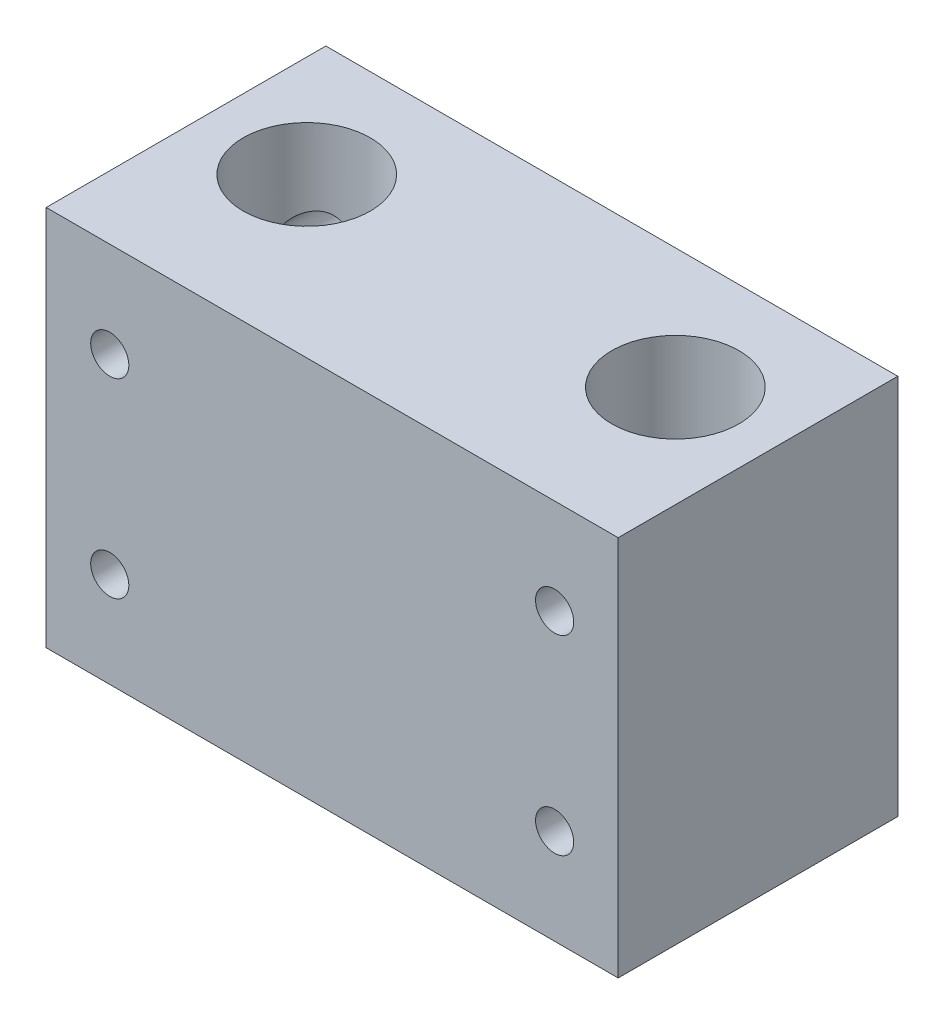
from build123d import *

# Parameters (mm, degrees)
SKETCH1_W           = 45
SKETCH1_H           = 30
BOSS_EXTRUDE2_DEPTH = 25
SKETCH4_R           = 1.5
CUT_EXTRUDE3_DEPTH  = 25
SKETCH5_R           = 5
CUT_EXTRUDE5_DEPTH  = 46.069390943
SKETCH7_W           = 45
SKETCH7_H           = 30
CUT_EXTRUDE8_DEPTH  = 3


with BuildPart() as part:
    # Sketch1 → Boss-Extrude2 (new body)
    with BuildSketch(Plane.XY):
        Rectangle(SKETCH1_W, SKETCH1_H)
    extrude(amount=BOSS_EXTRUDE2_DEPTH)

    # Sketch4 → Cut-Extrude3 (cut)
    with BuildSketch(Plane(origin=(0, 0, 0), x_dir=(-1, 0, 0), z_dir=(0, 0, -1))):
        with Locations((-17.5, 7.5)):
            Circle(SKETCH4_R)
        with Locations((17.5, 7.5)):
            Circle(SKETCH4_R)
        with Locations((-17.5, -7.5)):
            Circle(SKETCH4_R)
        with Locations((17.5, -7.5)):
            Circle(SKETCH4_R)
    extrude(amount=-CUT_EXTRUDE3_DEPTH, mode=Mode.SUBTRACT)

    # Sketch5 → Cut-Extrude5 (cut, through all)
    with BuildSketch(Plane(origin=(0, 15, 0), x_dir=(1, 0, 0), z_dir=(0, 1, 0))):
        with Locations(Location((-14.5, -12.5, 0), (0, 0, 270))):
            Circle(SKETCH5_R)
        with Locations(Location((14.5, -12.5, 0), (0, 0, 270))):
            Circle(SKETCH5_R)
    extrude(amount=-CUT_EXTRUDE5_DEPTH, mode=Mode.SUBTRACT)

    # Sketch7 → Cut-Extrude8 (cut)
    with BuildSketch(Plane(origin=(0, 0, 0), x_dir=(-1, 0, 0), z_dir=(0, 0, -1))):
        Rectangle(SKETCH7_W, SKETCH7_H)
    extrude(amount=-CUT_EXTRUDE8_DEPTH, mode=Mode.SUBTRACT)


solid = part.part
